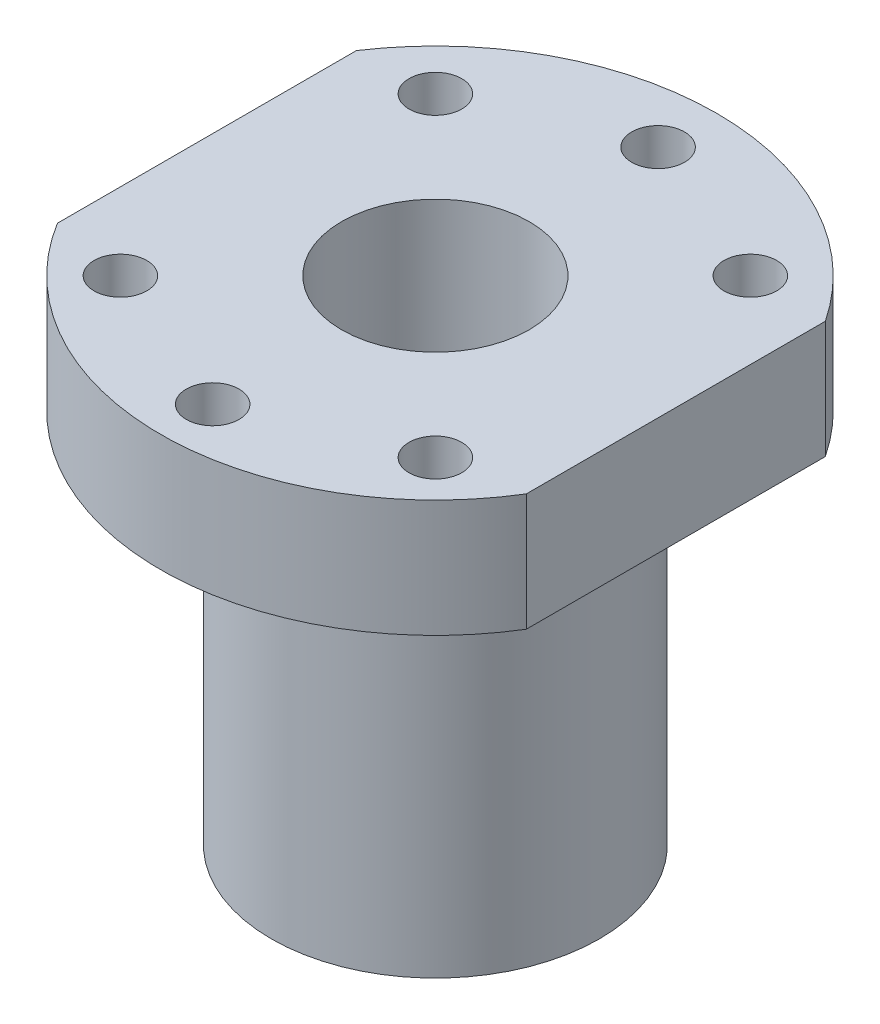
from build123d import *
from build123d.topology import SkipClean

# Parameters (mm, degrees)
SKETCH1_R      = 8
SKETCH1_R_2    = 2.25
EXTRUDE1_DEPTH = 10
EXTRUDE2_START = 32
SKETCH2_R      = 14
SKETCH2_R_2    = 8
EXTRUDE2_DEPTH = 32


with BuildPart() as part:
    # Sketch1 → Extrude1 (new body)
    with BuildSketch(Plane(origin=(0, 0, 0), x_dir=(1, 0, 0), z_dir=(0, 1, 0))):
        with BuildLine():
            Line((-81.996680828, 11.401457333), (-81.996680828, -14.105536597))
            ThreePointArc((-81.996680828, -14.105536597), (-101.996680828, -25.313489798), (-121.996680828, -14.105536597))
            Line((-121.996680828, -14.105536597), (-121.996680828, 11.401457333))
            ThreePointArc((-121.996680828, 11.401457333), (-101.996680828, 22.134958172), (-81.996680828, 11.401457333))
        make_face()
        with Locations(Location((-101.996680828, -1.865041828, 0), (0, 0, 270))):
            Circle(SKETCH1_R, mode=Mode.SUBTRACT)
        with Locations(Location((-101.996680828, 17.134958172, 0), (0, 0, 270))):
            Circle(SKETCH1_R_2, mode=Mode.SUBTRACT)
        with Locations(Location((-88.561651985, 11.569987015, 0), (0, 0, 270))):
            Circle(SKETCH1_R_2, mode=Mode.SUBTRACT)
        with Locations(Location((-115.43170967, 11.569987015, 0), (0, 0, 90))):
            Circle(SKETCH1_R_2, mode=Mode.SUBTRACT)
        with Locations(Location((-101.996680828, -20.865041828, 0), (0, 0, 270))):
            Circle(SKETCH1_R_2, mode=Mode.SUBTRACT)
        with Locations(Location((-88.561651985, -15.30007067, 0), (0, 0, 90))):
            Circle(SKETCH1_R_2, mode=Mode.SUBTRACT)
        with Locations(Location((-115.43170967, -15.30007067, 0), (0, 0, 270))):
            Circle(SKETCH1_R_2, mode=Mode.SUBTRACT)
    extrude(amount=EXTRUDE1_DEPTH)

    # Sketch2 → Extrude2 (add)
    with SkipClean():  # the faces are left unmerged after this step: merging them gives an invalid solid
        with BuildSketch(Plane.XZ.offset(EXTRUDE2_START)):
            with Locations(Location((-101.996680828, 1.865041828, 0), (0, 0, 90))):
                Circle(SKETCH2_R)
            with Locations(Location((-101.996680828, 1.865041828, 0), (0, 0, 270))):
                Circle(SKETCH2_R_2, mode=Mode.SUBTRACT)
        extrude(amount=-EXTRUDE2_DEPTH)


solid = part.part
